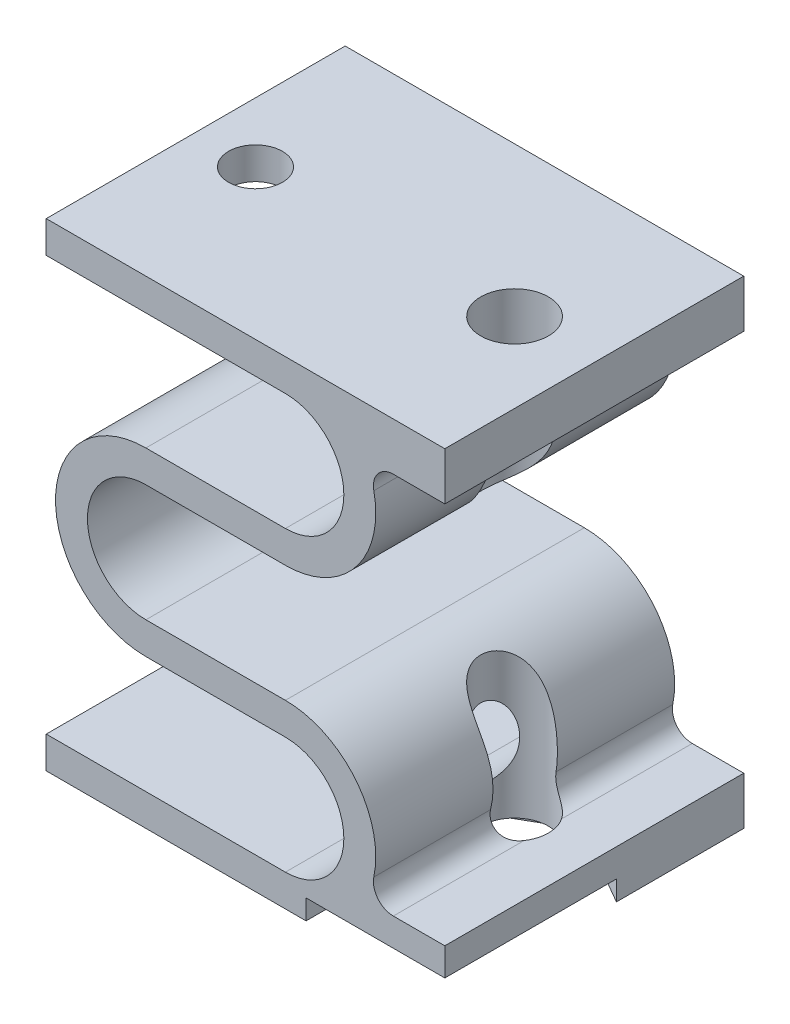
from build123d import *

# Parameters (mm, degrees)
BOSS_EXTRUDE1_DEPTH = 15
SKETCH2_R           = 1.7
CUT_EXTRUDE1_DEPTH  = 35.655446902
CUT_EXTRUDE2_DEPTH  = 1
CUT_EXTRUDE3_REACH  = 36.655
SKETCH4_R           = 1.35
CUT_EXTRUDE4_REACH  = 36.655
SKETCH5_R           = 1.35


with BuildPart() as part:
    # Sketch1 → Boss-Extrude1 (new body)
    with BuildSketch(Plane.XY):
        with BuildLine():
            Line((0, 0), (20, 0))
            Line((20, 0), (20, 2.4))
            Line((20, 2.4), (17.416025603, 2.4))
            ThreePointArc((17.416025603, 2.4), (16.639875077, 2.769452332), (16.437225795, 3.604819277))
            ThreePointArc((16.437225795, 3.604819277), (15.51854905, 7.391816094), (12, 9.066666667))
            Line((12, 9.066666667), (5, 9.066666667))
            ThreePointArc((5, 9.066666667), (2.066666667, 12), (5, 14.933333333))
            Line((5, 14.933333333), (12, 14.933333333))
            ThreePointArc((12, 14.933333333), (15.51854905, 16.608183906), (16.437225795, 20.395180723))
            ThreePointArc((16.437225795, 20.395180723), (16.639875077, 21.230547668), (17.416025603, 21.6))
            Line((17.416025603, 21.6), (20, 21.6))
            Line((20, 21.6), (20, 24))
            Line((20, 24), (0, 24))
            Line((0, 24), (0, 22.4))
            Line((0, 22.4), (12, 22.4))
            ThreePointArc((12, 22.4), (14.933333333, 19.466666667), (12, 16.533333333))
            Line((12, 16.533333333), (5, 16.533333333))
            ThreePointArc((5, 16.533333333), (0.466666667, 12), (5, 7.466666667))
            Line((5, 7.466666667), (12, 7.466666667))
            ThreePointArc((12, 7.466666667), (14.933333333, 4.533333333), (12, 1.6))
            Line((12, 1.6), (0, 1.6))
            Line((0, 1.6), (0, 0))
        make_face()
    extrude(amount=BOSS_EXTRUDE1_DEPTH)

    # Sketch2 → Cut-Extrude1 (cut, through all)
    with BuildSketch(Plane(origin=(0, 24, 0), x_dir=(1, 0, 0), z_dir=(0, 1, 0))):
        with Locations(Location((16, -7.5, 0), (0, 0, 270))):
            Circle(SKETCH2_R)
    extrude(amount=-CUT_EXTRUDE1_DEPTH, mode=Mode.SUBTRACT)

    # Sketch3 → Cut-Extrude2 (cut)
    with BuildSketch(Plane.XZ):
        Polygon((21.116195433, 7.033504944), (21.116195433, 15.482037177), (13.037905714, 15.482037177), (13.037905714, 5.789834067), (16, 4.079668134), align=None)
    extrude(amount=-CUT_EXTRUDE2_DEPTH, mode=Mode.SUBTRACT)

    # Sketch4 → Cut-Extrude3 (cut, up to next)
    with BuildSketch(Plane(origin=(0, 24, 0), x_dir=(1, 0, 0), z_dir=(0, 1, 0)), mode=Mode.PRIVATE) as cut_extrude3_sk1:
        with Locations(Location((3, -7.5, 0), (0, 0, 180))):
            Circle(SKETCH4_R)
    cut_extrude3_tool1 = extrude(cut_extrude3_sk1.sketch, amount=-CUT_EXTRUDE3_REACH, mode=Mode.PRIVATE) & part.part
    add(cut_extrude3_tool1.solids().sort_by_distance((3, 24, 7.5))[0], mode=Mode.SUBTRACT)

    # Sketch5 → Cut-Extrude4 (cut, up to next)
    with BuildSketch(Plane.XZ, mode=Mode.PRIVATE) as cut_extrude4_sk1:
        with Locations(Location((3, 7.5, 0), (0, 0, 180))):
            Circle(SKETCH5_R)
    cut_extrude4_tool1 = extrude(cut_extrude4_sk1.sketch, amount=-CUT_EXTRUDE4_REACH, mode=Mode.PRIVATE) & part.part
    add(cut_extrude4_tool1.solids().sort_by_distance((3, 0, 7.5))[0], mode=Mode.SUBTRACT)


solid = part.part
